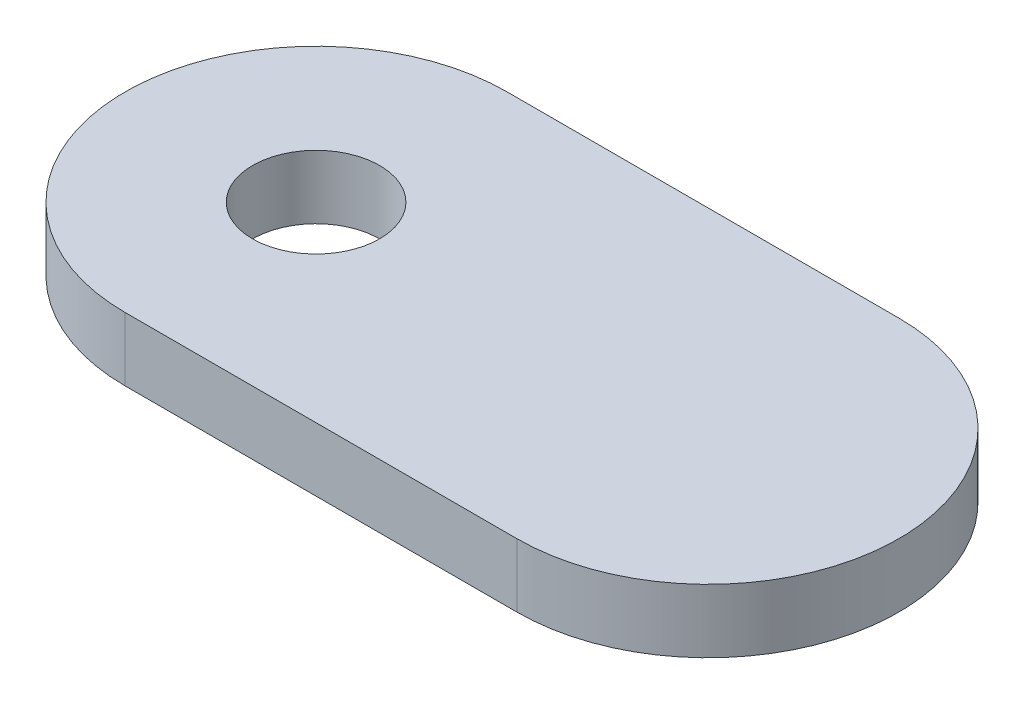
from build123d import *

# Parameters (mm, degrees)
DODANIE_WYCI_GNI_CIE1_DEPTH = 10
WYTNIJ_WYCI_GNI_CIE1_REACH  = 98.949
SZKIC2_R                    = 9.99307311


with BuildPart() as part:
    # Szkic1 → Dodanie-wyciągnięcie1 (new body)
    with BuildSketch(Plane(origin=(0, 0, 0), x_dir=(1, 0, 0), z_dir=(0, 1, 0))):
        with BuildLine():
            Line((0, 30.032086689), (61.604280389, 30.032086689))
            ThreePointArc((61.604280389, 30.032086689), (91.636367078, 0), (61.604280389, -30.032086689))
            Line((61.604280389, -30.032086689), (0, -30.032086689))
            ThreePointArc((0, -30.032086689), (-30.032086689, 0), (0, 30.032086689))
        make_face()
    extrude(amount=DODANIE_WYCI_GNI_CIE1_DEPTH)

    # Szkic2 → Wytnij-wyciągnięcie1 (cut, up to next)
    with BuildSketch(Plane(origin=(0, 10, 0), x_dir=(1, 0, 0), z_dir=(0, 1, 0)), mode=Mode.PRIVATE) as wytnij_wyci_gni_cie1_sk1:
        with Locations(Location((0, 0, 0), (0, 0, 270))):
            Circle(SZKIC2_R)
    wytnij_wyci_gni_cie1_tool1 = extrude(wytnij_wyci_gni_cie1_sk1.sketch, amount=-WYTNIJ_WYCI_GNI_CIE1_REACH, mode=Mode.PRIVATE) & part.part
    add(wytnij_wyci_gni_cie1_tool1.solids().sort_by_distance((0, 10, 0))[0], mode=Mode.SUBTRACT)


solid = part.part
